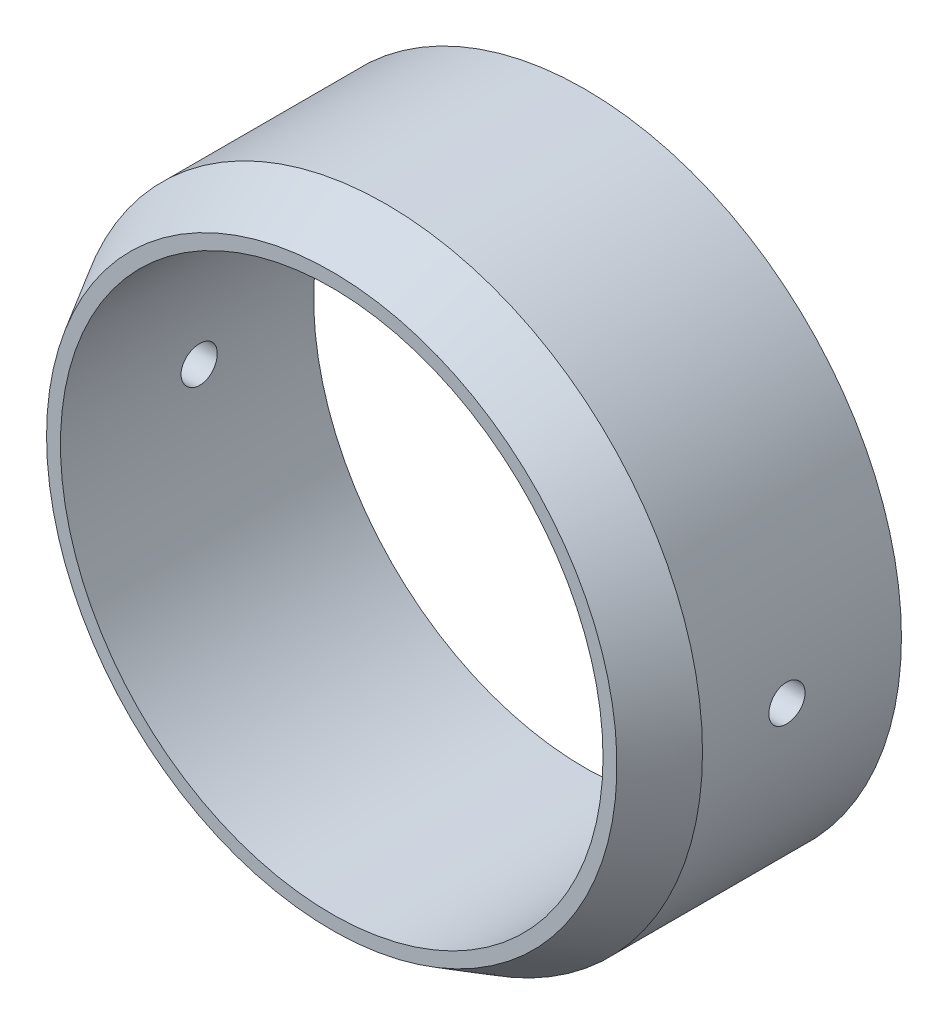
from build123d import *

# Parameters (mm, degrees)
SKETCH1_R               = 44.45
SKETCH1_R_2             = 38.1
BOSS_EXTRUDE1_DEPTH     = 35.56
CHAMFER1_SIZE           = 7.62
CHAMFER1_SIZE2          = 4.399409051
CUT_EXTRUDE1_DEPTH      = 73.222701417
CUT_EXTRUDE1_DEPTH_BACK = 73.222701417
SKETCH2_R               = 2.54


with BuildPart() as part:
    # Sketch1 → Boss-Extrude1 (new body)
    with BuildSketch(Plane.XY):
        Circle(SKETCH1_R)
        Circle(SKETCH1_R_2, mode=Mode.SUBTRACT)
    extrude(amount=BOSS_EXTRUDE1_DEPTH)

    # Chamfer1
    chamfer1_edges = [part.edges().sort_by_distance(p)[0] for p in [
        (-44.45, 0, 35.56),
    ]]
    chamfer1_side = [part.faces().sort_by_distance(p)[0] for p in [
        (-44.45, 0, 17.78),
    ]]
    chamfer(chamfer1_edges, length=CHAMFER1_SIZE, length2=CHAMFER1_SIZE2, reference=chamfer1_side[0])

    # Sketch2 → Cut-Extrude1 (cut, two sides: drawn at the far end of the back side and taken through both)
    with BuildSketch(Plane(origin=(0, 0, 0), x_dir=(0, 0, -1), z_dir=(1, 0, 0)).offset(-CUT_EXTRUDE1_DEPTH_BACK)):
        with Locations((-16.0782, 0)):
            Circle(SKETCH2_R)
    extrude(amount=CUT_EXTRUDE1_DEPTH + CUT_EXTRUDE1_DEPTH_BACK, mode=Mode.SUBTRACT)


solid = part.part
